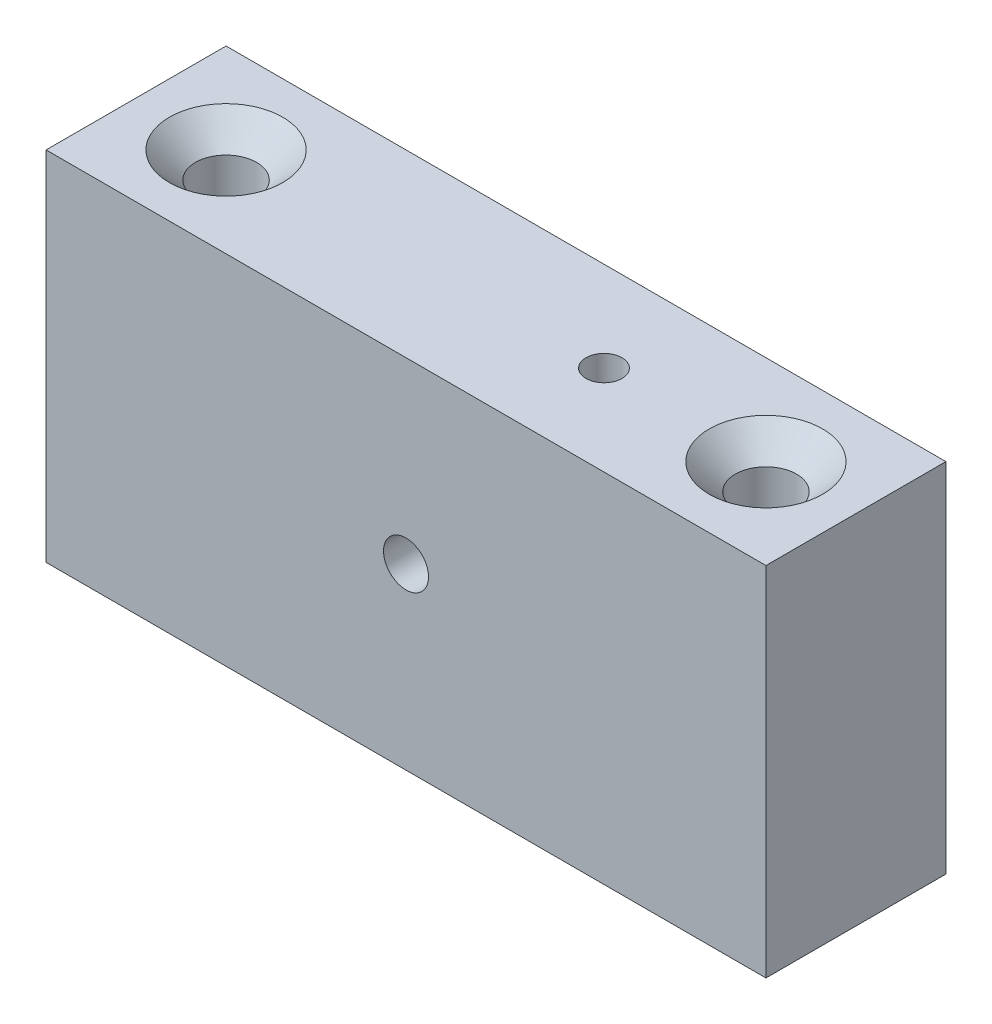
from build123d import *

# Parameters (mm, degrees)
SKETCH1_W                                       = 40
SKETCH1_H                                       = 10
BOSS_EXTRUDE1_DEPTH                             = 19.85
CSK_FOR_M3_FLAT_HEAD_MACHINE_SCREW1_D           = 3.4
CSK_FOR_M3_FLAT_HEAD_MACHINE_SCREW1_CSINK_D     = 6.3
CSK_FOR_M3_FLAT_HEAD_MACHINE_SCREW1_CSINK_ANGLE = 90
M3X0_5_TAPPED_HOLE1_D                           = 2.5
F_2_0MM_DOWEL_HOLE1_D                           = 2


with BuildPart() as part:
    # Sketch1 → Boss-Extrude1 (new body)
    with BuildSketch(Plane(origin=(0, 0, 0), x_dir=(1, 0, 0), z_dir=(0, 1, 0))):
        with Locations((20, 5)):
            Rectangle(SKETCH1_W, SKETCH1_H)
    extrude(amount=BOSS_EXTRUDE1_DEPTH)

    # CSK for M3 Flat Head Machine Screw1 (through all)
    with Locations(Plane(origin=(5, 19.85, -5), x_dir=(0, 0, 1), z_dir=(0, 1, 0))):
        with Locations((0, 0), (0, 30)):
            CounterSinkHole(CSK_FOR_M3_FLAT_HEAD_MACHINE_SCREW1_D / 2, CSK_FOR_M3_FLAT_HEAD_MACHINE_SCREW1_CSINK_D / 2, counter_sink_angle=CSK_FOR_M3_FLAT_HEAD_MACHINE_SCREW1_CSINK_ANGLE)

    # M3x0.5 Tapped Hole1 (through all)
    with Locations(Plane(origin=(20, 9.925, -10), x_dir=(-1, 0, 0), z_dir=(0, 0, -1))):
        with Locations((0, 0)):
            Hole(M3X0_5_TAPPED_HOLE1_D / 2)

    # Ø2.0mm Dowel Hole1 (through all)
    with Locations(Plane(origin=(26, 19.85, -5), x_dir=(0, 0, 1), z_dir=(0, 1, 0))):
        with Locations((0, 0)):
            Hole(F_2_0MM_DOWEL_HOLE1_D / 2)


solid = part.part
